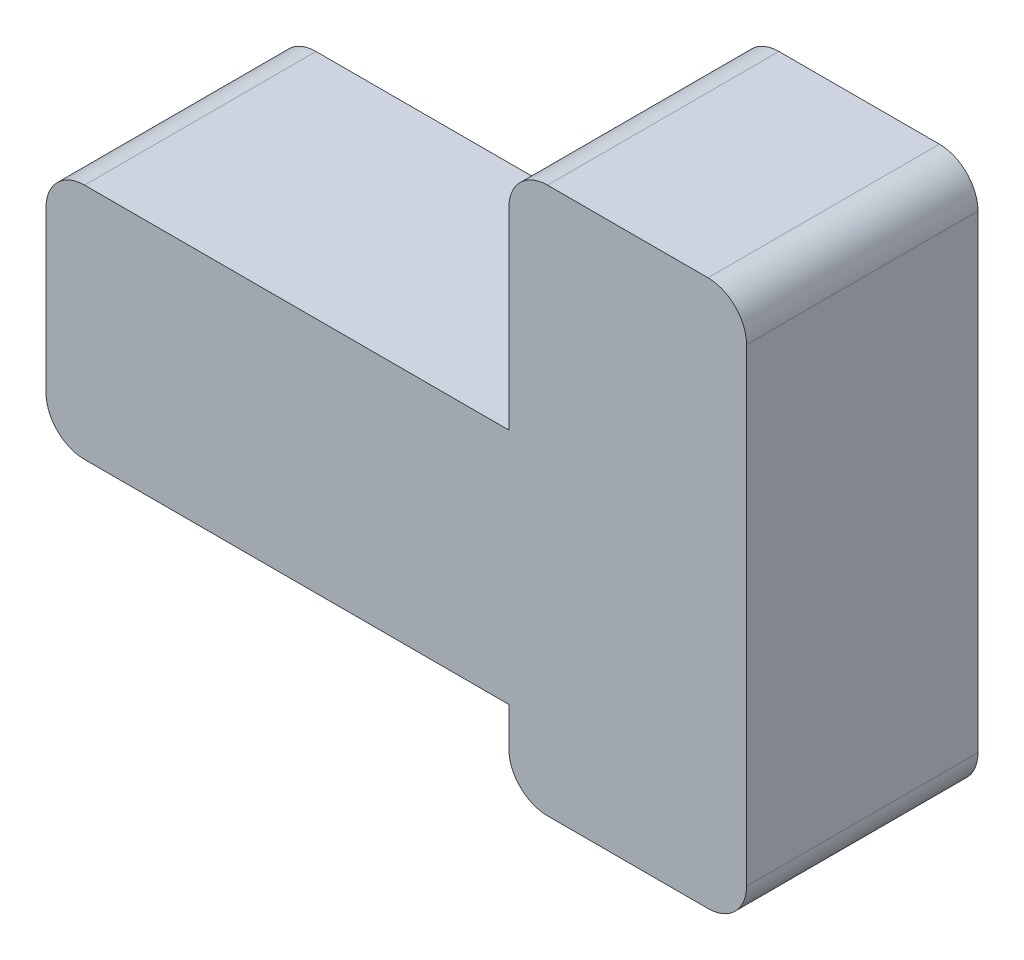
from build123d import *

# Parameters (mm, degrees)
BOSS_EXTRUDE1_DEPTH = 3
FILLET1_R           = 0.5


with BuildPart() as part:
    # Sketch1 → Boss-Extrude1 (new body)
    with BuildSketch(Plane.XY):
        Polygon((-16.055414073, 1.22942486), (-10.055414073, 1.22942486), (-10.055414073, 0.22942486), (-6.975414073, 0.22942486), (-6.975414073, 7.30942486), (-10.055414073, 7.30942486), (-10.055414073, 4.30942486), (-16.055414073, 4.30942486), align=None)
    extrude(amount=BOSS_EXTRUDE1_DEPTH)

    # Fillet1
    fillet1_edges = [part.edges().sort_by_distance(p)[0] for p in [
        (-16.055414073, 4.30942486, 1.5),
        (-10.055414073, 7.30942486, 1.5),
        (-6.975414073, 7.30942486, 1.5),
        (-6.975414073, 0.22942486, 1.5),
        (-10.055414073, 0.22942486, 1.5),
        (-16.055414073, 1.22942486, 1.5),
    ]]
    fillet(fillet1_edges, radius=FILLET1_R)


solid = part.part
